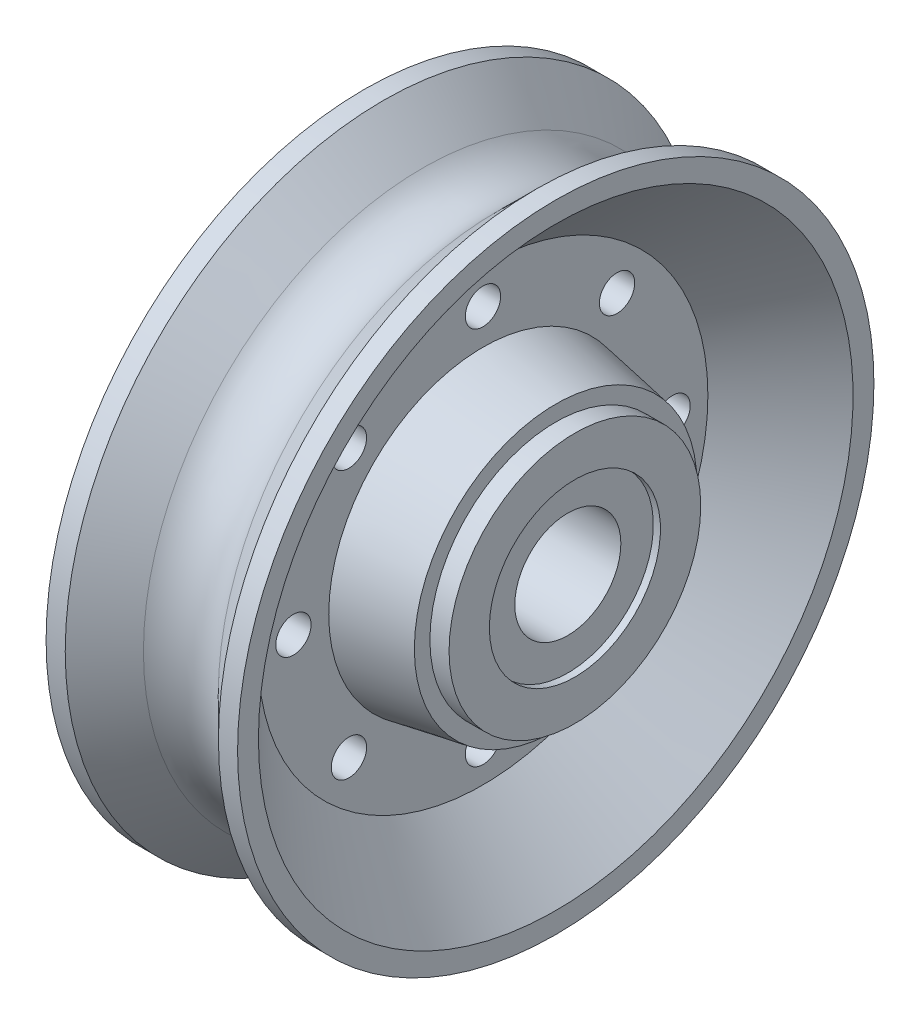
from build123d import *

# Parameters (mm, degrees)
SKETCH3_R          = 1.58676474
CUT_EXTRUDE1_DEPTH = 42.707767281
CIRPATTERN1_COUNT  = 8
SKETCH4_R          = 14.605
SKETCH4_R_2        = 11.303
CUT_EXTRUDE2_DEPTH = 1.719791667
SKETCH5_R          = 7.6835
CUT_EXTRUDE3_DEPTH = 0.635


with BuildPart() as part:
    # Sketch1 → Revolve1 (revolve)
    with BuildSketch(Plane.XY, mode=Mode.PRIVATE) as revolve1_sk:
        with BuildLine():
            Line((6.879166667, 28.575), (8.598958333, 28.575))
            Line((8.598958333, 28.575), (8.598958333, 12.7))
            Line((8.598958333, 12.7), (10.31875, 12.7))
            Line((10.31875, 12.7), (10.31875, 4.7625))
            Line((10.31875, 4.7625), (-10.31875, 4.7625))
            Line((-10.31875, 4.7625), (-10.31875, 12.7))
            Line((-10.31875, 12.7), (-8.598958333, 12.7))
            Line((-8.598958333, 12.7), (-8.598958333, 28.575))
            Line((-8.598958333, 28.575), (-6.879166667, 28.575))
            Line((-6.879166667, 28.575), (-3.359436659, 25.07226429))
            ThreePointArc((-3.359436659, 25.07226429), (0, 23.6855), (3.359436659, 25.07226429))
            Line((3.359436659, 25.07226429), (6.879166667, 28.575))
        make_face()
    revolve(revolve1_sk.sketch.rotate(Axis((-10.31875, 0, 0), (1, 0, 0)), 90), axis=Axis((-10.31875, 0, 0), (1, 0, 0)))

    # Sketch2 → Cut-Revolve1 (revolve, cut)
    with BuildSketch(Plane.XY, mode=Mode.PRIVATE) as cut_revolve1_sk:
        Polygon((-10.31875, 12.7), (-8.598958333, 12.7), (-2.06375, 13.852333554), (-2.06375, 20.199392515), (-10.31875, 28.414534933), align=None)
        Polygon((10.31875, 12.7), (10.31875, 28.414534933), (2.06375, 20.199392515), (2.06375, 13.852333554), (8.598958333, 12.7), align=None)
    revolve(cut_revolve1_sk.sketch.rotate(Axis((-10.31875, 0, 0), (1, 0, 0)), 90), axis=Axis((-10.31875, 0, 0), (1, 0, 0)), mode=Mode.SUBTRACT)

    # Sketch3 → Cut-Extrude1 (cut, symmetric)
    with BuildSketch(Plane(origin=(0, 0, 0), x_dir=(0, 0, -1), z_dir=(1, 0, 0))):
        with Locations((0, 17.025863034)):
            Circle(SKETCH3_R)
    cut_extrude1 = extrude(amount=CUT_EXTRUDE1_DEPTH, both=True, mode=Mode.SUBTRACT)

    # CirPattern1: Cut-Extrude1 ×8 about axis
    cirpattern1_axis = Axis((0, 0, 0), (1, 0, 0))
    for i in range(1, CIRPATTERN1_COUNT):
        add(cut_extrude1.rotate(cirpattern1_axis, i * 360 / CIRPATTERN1_COUNT), mode=Mode.SUBTRACT)

    # Sketch4 → Cut-Extrude2 (cut)
    with BuildSketch(Plane.ZY.offset(10.31875)):
        Circle(SKETCH4_R)
        Circle(SKETCH4_R_2, mode=Mode.SUBTRACT)
    cut_extrude2 = extrude(amount=-CUT_EXTRUDE2_DEPTH, mode=Mode.SUBTRACT)

    # Sketch5 → Cut-Extrude3 (cut)
    with BuildSketch(Plane.ZY.offset(10.31875)):
        Circle(SKETCH5_R)
    cut_extrude3 = extrude(amount=-CUT_EXTRUDE3_DEPTH, mode=Mode.SUBTRACT)

    # Mirror1: Cut-Extrude2, Cut-Extrude3 across plane
    add(cut_extrude2.mirror(Plane(origin=(0, 0, 0), x_dir=(0, 0, 1), z_dir=(1, 0, 0))), mode=Mode.SUBTRACT)
    add(cut_extrude3.mirror(Plane(origin=(0, 0, 0), x_dir=(0, 0, 1), z_dir=(1, 0, 0))), mode=Mode.SUBTRACT)


solid = part.part
